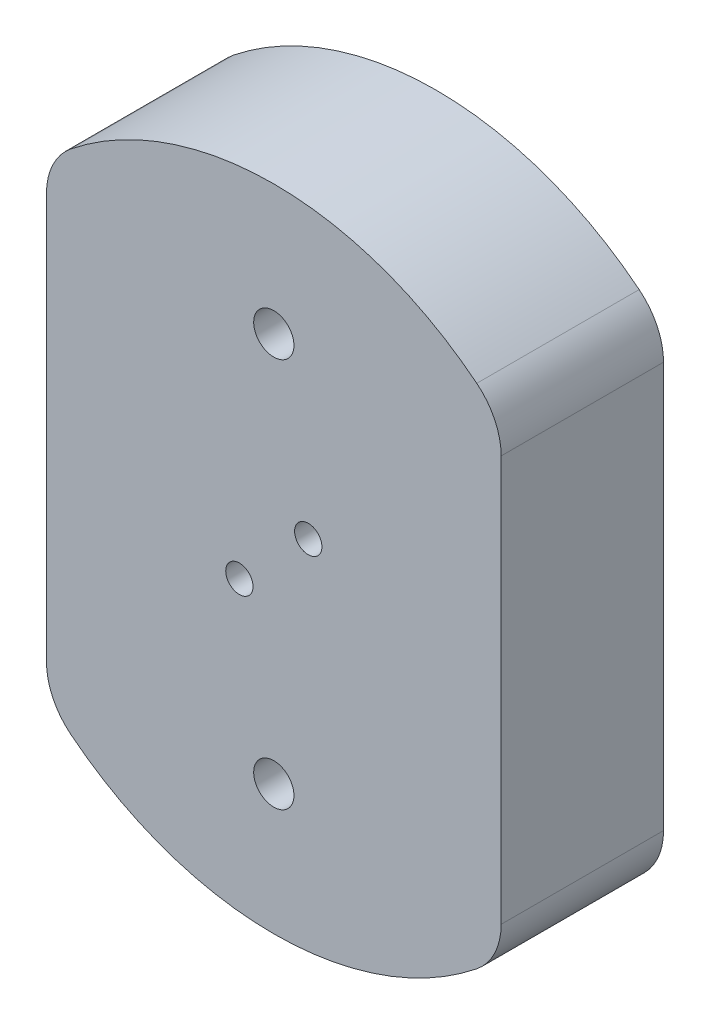
from build123d import *

# Parameters (mm, degrees)
SKETCH1_R           = 50
BOSS_EXTRUDE1_DEPTH = 20
SKETCH2_R           = 50
BOSS_EXTRUDE2_DEPTH = 5
SKETCH3_R           = 2.1
CUT_EXTRUDE1_DEPTH  = 5
SKETCH4_R           = 3.1
CUT_EXTRUDE2_DEPTH  = 76
CUT_EXTRUDE3_DEPTH  = 6
FILLET1_R           = 0.5
CUT_EXTRUDE4_DEPTH  = 76
FILLET2_R           = 10


with BuildPart() as part:
    # Sketch1 → Boss-Extrude1 (new body)
    with BuildSketch(Plane.XY):
        Circle(SKETCH1_R)
        with BuildLine():
            Line((-8.972179222, 12.02081528), (8.972179222, 12.02081528))
            ThreePointArc((8.972179222, 12.02081528), (10.606601718, 10.606601718), (12.02081528, 8.972179222))
            Line((12.02081528, 8.972179222), (12.02081528, -8.972179222))
            ThreePointArc((12.02081528, -8.972179222), (10.606601708, -10.606601708), (8.972179222, -12.02081528))
            Line((8.972179222, -12.02081528), (-8.972179222, -12.02081528))
            ThreePointArc((-8.972179222, -12.02081528), (-10.606601718, -10.606601718), (-12.02081528, -8.972179222))
            Line((-12.02081528, -8.972179222), (-12.02081528, 8.972179222))
            ThreePointArc((-12.02081528, 8.972179222), (-10.606601718, 10.606601718), (-8.972179222, 12.02081528))
        make_face(mode=Mode.SUBTRACT)
    extrude(amount=BOSS_EXTRUDE1_DEPTH)

    # Sketch2 → Boss-Extrude2 (add)
    with BuildSketch(Plane.XY.offset(20)):
        Circle(SKETCH2_R)
    extrude(amount=BOSS_EXTRUDE2_DEPTH)

    # Sketch3 → Cut-Extrude1 (cut)
    with BuildSketch(Plane(origin=(0, 0, 20), x_dir=(-1, 0, 0), z_dir=(0, 0, -1))):
        with Locations((-5.303300859, 5.303300859)):
            Circle(SKETCH3_R)
        with Locations((5.303300859, -5.303300859)):
            Circle(SKETCH3_R)
    extrude(amount=-CUT_EXTRUDE1_DEPTH, mode=Mode.SUBTRACT)

    # Sketch4 → Cut-Extrude2 (cut, through all)
    with BuildSketch(Plane(origin=(0, 0, 0), x_dir=(-1, 0, 0), z_dir=(0, 0, -1))):
        with Locations((0, 30)):
            Circle(SKETCH4_R)
        with Locations((0, -30)):
            Circle(SKETCH4_R)
    extrude(amount=-CUT_EXTRUDE2_DEPTH, mode=Mode.SUBTRACT)

    # Sketch5 → Cut-Extrude3 (cut)
    with BuildSketch(Plane(origin=(0, 0, 0), x_dir=(-1, 0, 0), z_dir=(0, 0, -1))):
        Polygon((5.831237719, 30), (2.915618859, 35.05), (-2.915618859, 35.05), (-5.831237719, 30), (-2.915618859, 24.95), (2.915618859, 24.95), align=None)
        Polygon((5.831237719, -30), (2.915618859, -24.95), (-2.915618859, -24.95), (-5.831237719, -30), (-2.915618859, -35.05), (2.915618859, -35.05), align=None)
    extrude(amount=-CUT_EXTRUDE3_DEPTH, mode=Mode.SUBTRACT)

    # Fillet1
    fillet1_edges = [part.edges().sort_by_distance(p)[0] for p in [
        (-4.373428289, 27.475, 0),
        (-4.373428289, 32.525, 0),
        (0, 35.05, 0),
        (4.373428289, 32.525, 0),
        (4.373428289, 27.475, 0),
        (0, 24.95, 0),
        (-4.373428289, -32.525, 0),
        (-4.373428289, -27.475, 0),
        (0, -24.95, 0),
        (4.373428289, -27.475, 0),
        (4.373428289, -32.525, 0),
        (0, -35.05, 0),
    ]]
    fillet(fillet1_edges, radius=FILLET1_R)

    # Sketch6 → Cut-Extrude4 (cut, through all)
    with BuildSketch(Plane(origin=(0, 0, 0), x_dir=(-1, 0, 0), z_dir=(0, 0, -1))):
        with BuildLine():
            Line((-35, 0), (-35, 35.707142143))
            ThreePointArc((-35, 35.707142143), (-50, 0), (-35, -35.707142143))
            Line((-35, -35.707142143), (-35, 0))
        make_face()
    cut_extrude4 = extrude(amount=-CUT_EXTRUDE4_DEPTH, mode=Mode.SUBTRACT)

    # Mirror1: Cut-Extrude4 across plane
    add(cut_extrude4.mirror(Plane(origin=(0, 0, 0), x_dir=(0, 0, 1), z_dir=(1, 0, 0))), mode=Mode.SUBTRACT)

    # Fillet2
    fillet2_edges = [part.edges().sort_by_distance(p)[0] for p in [
        (35, -35.707142143, 12.5),
        (35, 35.707142143, 12.5),
        (-35, -35.707142143, 12.5),
        (-35, 35.707142143, 12.5),
    ]]
    fillet(fillet2_edges, radius=FILLET2_R)


solid = part.part
